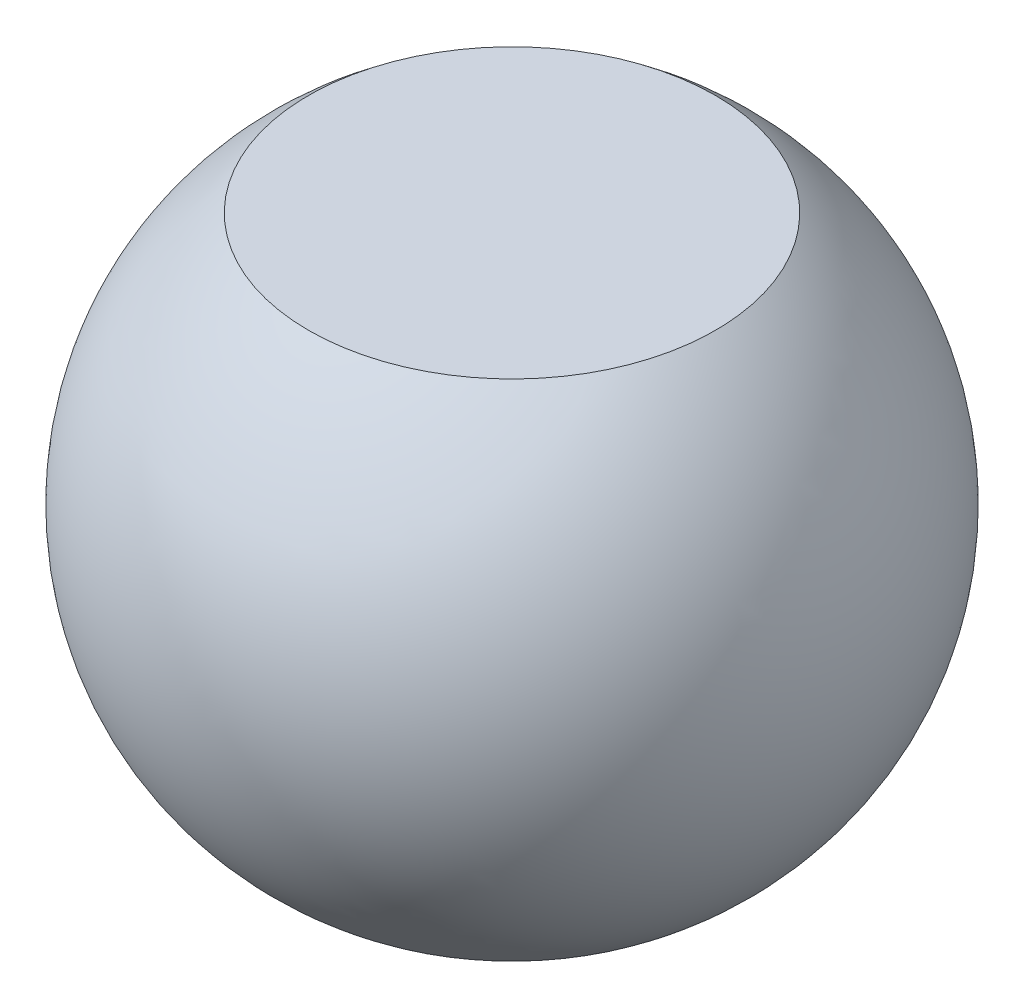
from build123d import *


with BuildPart() as part:
    # Sketch2 → Revolve1 (revolve)
    with BuildSketch(Plane(origin=(0, 0, 0), x_dir=(0, 0, -1), z_dir=(1, 0, 0))):
        with BuildLine():
            Line((323, 0), (0, 0))
            Line((0, 0), (0, 805))
            Line((0, 805), (324.416814066, 805))
            ThreePointArc((324.416814066, 805), (525.712680599, 402.144468949), (323, 0))
        make_face()
    revolve(axis=Axis((0, 0, 0), (0, 1, 0)))


solid = part.part
